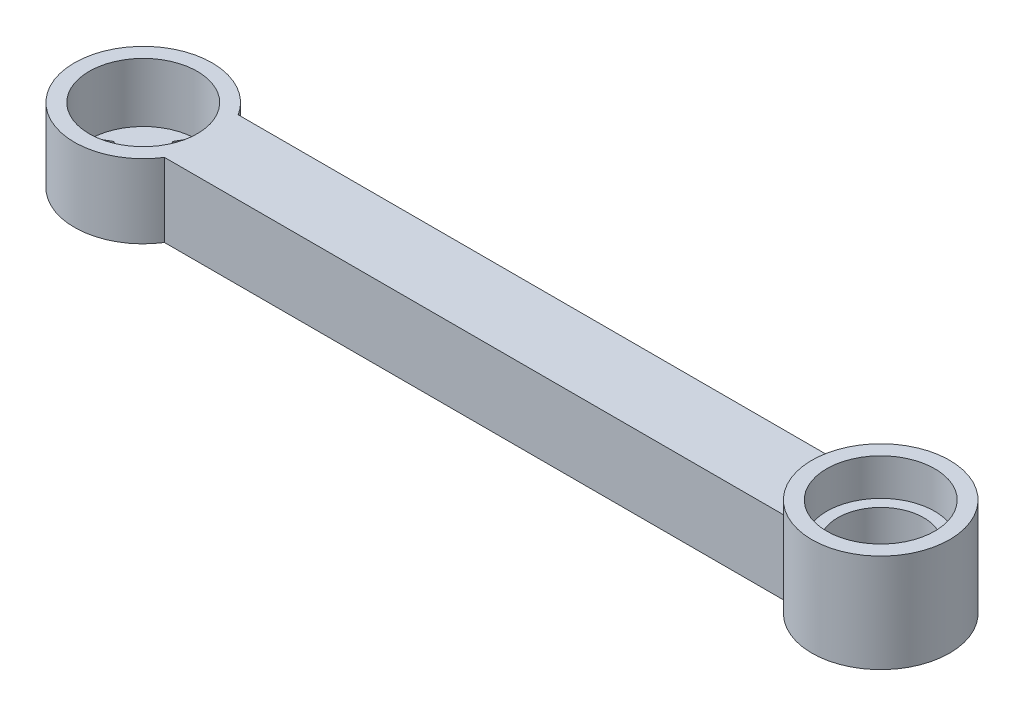
from build123d import *

# Parameters (mm, degrees)
SKETCH2_R                             = 14
SKETCH2_R_2                           = 11
BOSS_EXTRUDE7_DEPTH                   = 15
SKETCH2_12_R                          = 11
BOSS_EXTRUDE10_DEPTH                  = 3
SKETCH2_9_R                           = 14
SKETCH2_9_R_2                         = 11
BOSS_EXTRUDE8_DEPTH                   = 20
SKETCH2_11_R                          = 11
SKETCH2_11_R_2                        = 8.75
BOSS_EXTRUDE9_DEPTH                   = 12.5
BOSS_EXTRUDE11_REACH                  = 119.015
BOSS_EXTRUDE11_END_RADIUS             = 14
BOSS_EXTRUDE11_DIRECTION_2_REACH      = 119.015
BOSS_EXTRUDE11_DIRECTION_2_END_RADIUS = 14
CUT_EXTRUDE6_DEPTH                    = 1.1
SKETCH13_R                            = 1.15
CUT_EXTRUDE7_DEPTH                    = 3
BOSS_EXTRUDE12_REACH                  = 119.21
SKETCH15_W                            = 3
SKETCH15_H                            = 9.5
FILLET1_R                             = 2


with BuildPart() as part:
    # Sketch2 → Boss-Extrude7 (new body)
    with BuildSketch(Plane(origin=(0, 0, 0), x_dir=(1, 0, 0), z_dir=(0, 1, 0))):
        with Locations(Location((-50, 3.220631283, 0), (0, 0, 270))):
            Circle(SKETCH2_R)
        with Locations(Location((-50, 3.220631283, 0), (0, 0, 270))):
            Circle(SKETCH2_R_2, mode=Mode.SUBTRACT)
    extrude(amount=BOSS_EXTRUDE7_DEPTH)

    # Sketch2<12> → Boss-Extrude10 (add)
    with BuildSketch(Plane(origin=(0, 0, 0), x_dir=(1, 0, 0), z_dir=(0, 1, 0))):
        with Locations(Location((-50, 3.220631283, 0), (0, 0, 270))):
            Circle(SKETCH2_12_R)
    extrude(amount=BOSS_EXTRUDE10_DEPTH)


with BuildPart() as body_2:
    # Sketch2<9> → Boss-Extrude8 (new body)
    with BuildSketch(Plane(origin=(0, 0, 0), x_dir=(1, 0, 0), z_dir=(0, 1, 0))):
        with Locations(Location((100, 3.220631283, 0), (0, 0, 270))):
            Circle(SKETCH2_9_R)
        with Locations(Location((100, 3.220631283, 0), (0, 0, 270))):
            Circle(SKETCH2_9_R_2, mode=Mode.SUBTRACT)
    extrude(amount=BOSS_EXTRUDE8_DEPTH)

    # Sketch2<11> → Boss-Extrude9 (add)
    with BuildSketch(Plane(origin=(0, 0, 0), x_dir=(1, 0, 0), z_dir=(0, 1, 0))):
        with Locations(Location((100, 3.220631283, 0), (0, 0, 270))):
            Circle(SKETCH2_11_R)
        with Locations(Location((100, 3.220631283, 0), (0, 0, 270))):
            Circle(SKETCH2_11_R_2, mode=Mode.SUBTRACT)
    extrude(amount=BOSS_EXTRUDE9_DEPTH)


    add(part.part)  # Boss-Extrude11 merges part
    # Boss-Extrude11: up to this cylinder (the profile starts outside it)
    boss_extrude11_end = Plane(origin=(-50, 0.212132, -3.220631283), z_dir=(0, -1, 0)) * Cylinder(BOSS_EXTRUDE11_END_RADIUS, 267.03, mode=Mode.PRIVATE)
    # Sketch3 → Boss-Extrude11 (add, up to the surface)
    with BuildSketch(Plane(origin=(0, 0, 0), x_dir=(0, 0, -1), z_dir=(1, 0, 0)), mode=Mode.PRIVATE) as boss_extrude11_sk1:
        Polygon((10.720631283, 0), (10.720631283, 15), (-4.279368717, 15), (-4.279368717, 0), (-1.279368717, 0), (-1.279368717, 12), (7.720631283, 12), (7.720631283, 0), align=None)
    boss_extrude11_tool1 = extrude(boss_extrude11_sk1.sketch, amount=-BOSS_EXTRUDE11_REACH, mode=Mode.PRIVATE) - boss_extrude11_end
    add(boss_extrude11_tool1.solids().sort_by_distance((0, 0.212132, -9.220631))[0])

    # Boss-Extrude11 direction 2: up to this cylinder (the profile starts outside it)
    boss_extrude11_direction_2_end = Plane(origin=(100, 0.212132, -3.220631283), z_dir=(0, -1, 0)) * Cylinder(BOSS_EXTRUDE11_DIRECTION_2_END_RADIUS, 267.03, mode=Mode.PRIVATE)
    # Sketch3 → Boss-Extrude11 direction 2 (add, up to the surface)
    with BuildSketch(Plane(origin=(0, 0, 0), x_dir=(0, 0, -1), z_dir=(1, 0, 0)), mode=Mode.PRIVATE) as boss_extrude11_direction_2_sk1:
        Polygon((10.720631283, 0), (10.720631283, 15), (-4.279368717, 15), (-4.279368717, 0), (-1.279368717, 0), (-1.279368717, 12), (7.720631283, 12), (7.720631283, 0), align=None)
    boss_extrude11_direction_2_tool1 = extrude(boss_extrude11_direction_2_sk1.sketch, amount=BOSS_EXTRUDE11_DIRECTION_2_REACH, mode=Mode.PRIVATE) - boss_extrude11_direction_2_end
    add(boss_extrude11_direction_2_tool1.solids().sort_by_distance((0, 0.212132, -9.220631))[0])

    # Sketch10 → Cut-Extrude6 (cut)
    with BuildSketch(Plane(origin=(0, 3, 0), x_dir=(1, 0, 0), z_dir=(0, 1, 0))):
        Polygon((-47.85, 11.358676665), (-48.925, 13.220631283), (-51.075, 13.220631283), (-52.15, 11.358676665), (-51.075, 9.496722047), (-48.925, 9.496722047), align=None)
        Polygon((-58.138045382, 5.37063128), (-60, 4.29563128), (-60, 2.14563128), (-58.138045382, 1.07063128), (-56.276090764, 2.14563128), (-56.276090764, 4.29563128), align=None)
        Polygon((-41.861954618, 5.37063128), (-43.723909236, 4.29563128), (-43.723909236, 2.14563128), (-41.861954618, 1.07063128), (-40, 2.14563128), (-40, 4.29563128), align=None)
        Polygon((-47.85, -4.917414098), (-48.925, -3.05545948), (-51.075, -3.05545948), (-52.15, -4.917414098), (-51.075, -6.779368717), (-48.925, -6.779368717), align=None)
    extrude(amount=-CUT_EXTRUDE6_DEPTH, mode=Mode.SUBTRACT)

    # Sketch13 → Cut-Extrude7 (cut)
    with BuildSketch(Plane(origin=(0, 3, 0), x_dir=(1, 0, 0), z_dir=(0, 1, 0))):
        with Locations(Location((-50, 11.35867667, 0), (0, 0, 270))):
            Circle(SKETCH13_R)
        with Locations(Location((-41.86195462, 3.22063128, 0), (0, 0, 270))):
            Circle(SKETCH13_R)
        with Locations(Location((-50, -4.9174141, 0), (0, 0, 270))):
            Circle(SKETCH13_R)
        with Locations(Location((-58.13804538, 3.22063128, 0), (0, 0, 270))):
            Circle(SKETCH13_R)
    extrude(amount=-CUT_EXTRUDE7_DEPTH, mode=Mode.SUBTRACT)

    # Sketch15 → Boss-Extrude12 (add, up to next)
    with BuildSketch(Plane.XY.offset(-7.720631283), mode=Mode.PRIVATE) as boss_extrude12_sk1:
        with Locations((-13.807045748, 7.25)):
            Rectangle(SKETCH15_W, SKETCH15_H)
    boss_extrude12_tool1 = extrude(boss_extrude12_sk1.sketch, amount=BOSS_EXTRUDE12_REACH, mode=Mode.PRIVATE) - body_2.part
    # Sketch15 → Boss-Extrude12 (add, up to next)
    with BuildSketch(Plane.XY.offset(-7.720631283), mode=Mode.PRIVATE) as boss_extrude12_sk2:
        with Locations((12.064318086, 7.25)):
            Rectangle(SKETCH15_W, SKETCH15_H)
    boss_extrude12_tool2 = extrude(boss_extrude12_sk2.sketch, amount=BOSS_EXTRUDE12_REACH, mode=Mode.PRIVATE) - body_2.part
    # Sketch15 → Boss-Extrude12 (add, up to next)
    with BuildSketch(Plane.XY.offset(-7.720631283), mode=Mode.PRIVATE) as boss_extrude12_sk3:
        with Locations((37.93568192, 7.25)):
            Rectangle(SKETCH15_W, SKETCH15_H)
    boss_extrude12_tool3 = extrude(boss_extrude12_sk3.sketch, amount=BOSS_EXTRUDE12_REACH, mode=Mode.PRIVATE) - body_2.part
    # Sketch15 → Boss-Extrude12 (add, up to next)
    with BuildSketch(Plane.XY.offset(-7.720631283), mode=Mode.PRIVATE) as boss_extrude12_sk4:
        with Locations((63.807045754, 7.25)):
            Rectangle(SKETCH15_W, SKETCH15_H)
    boss_extrude12_tool4 = extrude(boss_extrude12_sk4.sketch, amount=BOSS_EXTRUDE12_REACH, mode=Mode.PRIVATE) - body_2.part
    add(boss_extrude12_tool1.solids().sort_by_distance((-13.807046, 7.25, -7.720631))[0])
    add(boss_extrude12_tool2.solids().sort_by_distance((12.064318, 7.25, -7.720631))[0])
    add(boss_extrude12_tool3.solids().sort_by_distance((37.935682, 7.25, -7.720631))[0])
    add(boss_extrude12_tool4.solids().sort_by_distance((63.807046, 7.25, -7.720631))[0])

    # Fillet1
    fillet1_edges = [body_2.edges().sort_by_distance(p)[0] for p in [
        (-15.307045748, 7.25, 1.279368717),
        (-12.307045748, 7.25, 1.279368717),
        (-12.307045748, 7.25, -7.720631283),
        (-15.307045748, 7.25, -7.720631283),
        (13.564318086, 7.25, 1.279368717),
        (10.564318086, 7.25, 1.279368717),
        (13.564318086, 7.25, -7.720631283),
        (10.564318086, 7.25, -7.720631283),
        (36.43568192, 7.25, 1.279368717),
        (39.43568192, 7.25, 1.279368717),
        (39.43568192, 7.25, -7.720631283),
        (36.43568192, 7.25, -7.720631283),
        (62.307045754, 7.25, 1.279368717),
        (65.307045754, 7.25, 1.279368717),
        (65.307045754, 7.25, -7.720631283),
        (62.307045754, 7.25, -7.720631283),
    ]]
    fillet(fillet1_edges, radius=FILLET1_R)


solid = body_2.part
